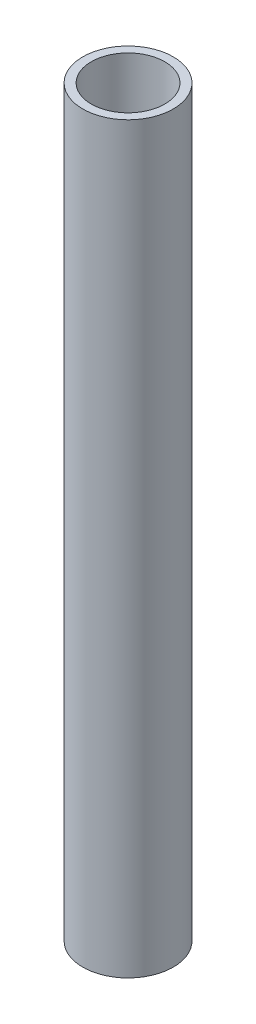
from build123d import *

# Parameters (mm, degrees)
SKETCH_1_R      = 10.65
SKETCH_1_R_2    = 8.65
EXTRUDE_1_DEPTH = 175


with BuildPart() as part:
    # Эскиз1 → Бобышка-Вытянуть1 (new body)
    with BuildSketch(Plane(origin=(0, 0, 0), x_dir=(1, 0, 0), z_dir=(0, 1, 0))):
        with Locations(Location((0, -1.5, 0), (0, 0, 90))):
            Circle(SKETCH_1_R)
        with Locations(Location((0, -1.5, 0), (0, 0, 90))):
            Circle(SKETCH_1_R_2, mode=Mode.SUBTRACT)
    extrude(amount=EXTRUDE_1_DEPTH)


solid = part.part
